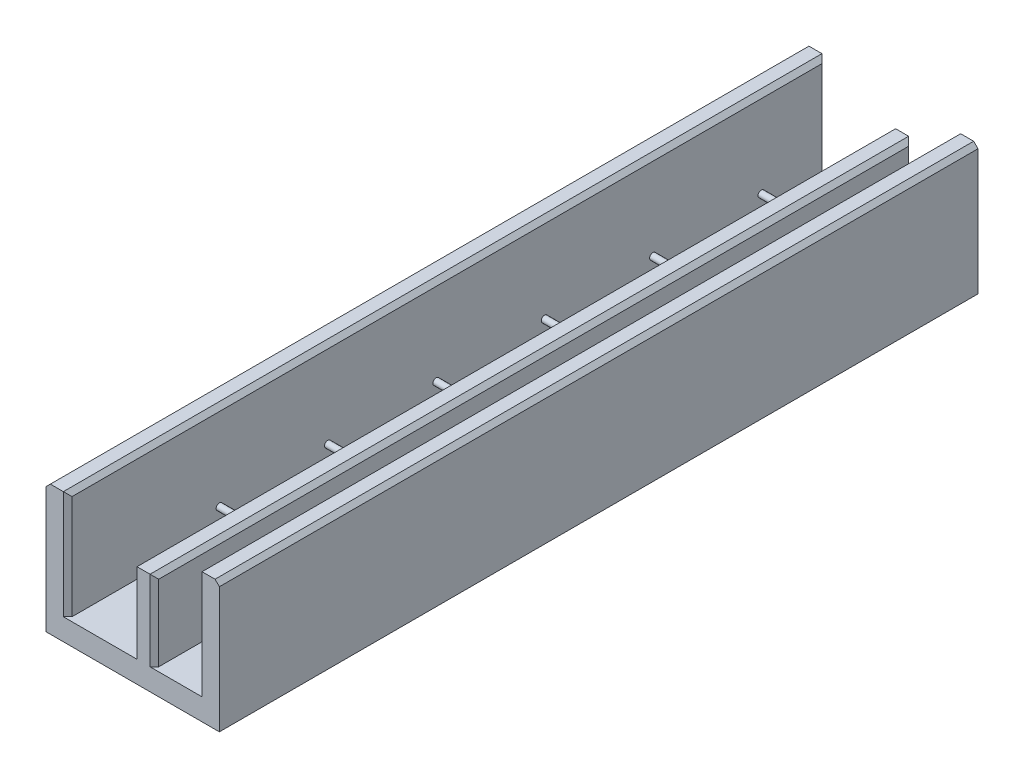
from build123d import *

# Parameters (mm, degrees)
SALIENTE_EXTRUIR1_DEPTH = 3500
CHAFL_N2_SIZE           = 20
SALIENTE_EXTRUIR2_REACH = 3642.055
CROQUIS2_R              = 15
MATRIZL1_COUNT          = 6
MATRIZL1_PITCH          = 500


with BuildPart() as part:
    # Croquis1 → Saliente-Extruir1 (new body)
    with BuildSketch(Plane.XY):
        Polygon((0, 0), (-800, 0), (-800, 600), (-700, 600), (-700, 100), (-400, 100), (-400, 470), (-300, 470), (-300, 100), (-100, 100), (-100, 600), (0, 600), align=None)
    extrude(amount=SALIENTE_EXTRUIR1_DEPTH)

    # Chaflán2
    chafl_n2_edges = [part.edges().sort_by_distance(p)[0] for p in [
        (-100, 350, 3500),
        (-700, 350, 0),
        (-400, 285, 0),
        (-300, 285, 0),
        (-100, 350, 0),
        (-300, 285, 3500),
        (-800, 600, 1750),
        (-700, 600, 1750),
        (-400, 470, 1750),
        (-300, 470, 1750),
        (-100, 600, 1750),
        (0, 600, 1750),
        (-400, 285, 3500),
        (-700, 350, 3500),
    ]]
    chamfer(chafl_n2_edges, length=CHAFL_N2_SIZE)

    # Saliente-Extruir2: up to this face of the body (flat: up to its plane)
    saliente_extruir2_end = Plane(part.part.faces().sort_by_distance((-100, 340, 1750))[0])
    # Croquis2 → Saliente-Extruir2 (add, up to the picked face)
    with BuildSketch(Plane.ZY.offset(800), mode=Mode.PRIVATE) as saliente_extruir2_sk1:
        with Locations(Location((300, 200, 0), (0, 0, 270))):
            Circle(CROQUIS2_R)
    saliente_extruir2_tool1 = split(extrude(saliente_extruir2_sk1.sketch, amount=-SALIENTE_EXTRUIR2_REACH, mode=Mode.PRIVATE), bisect_by=saliente_extruir2_end, keep=Keep.BOTH, mode=Mode.PRIVATE)
    saliente_extruir2 = saliente_extruir2_tool1.solids().sort_by(Axis((-800, 200, 300), (1, 0, 0)))[0]
    add(saliente_extruir2)

    # MatrizL1: Saliente-Extruir2 ×6
    with Locations(*[(0, 0, i * MATRIZL1_PITCH) for i in range(1, MATRIZL1_COUNT)]):
        add(saliente_extruir2)


solid = part.part
